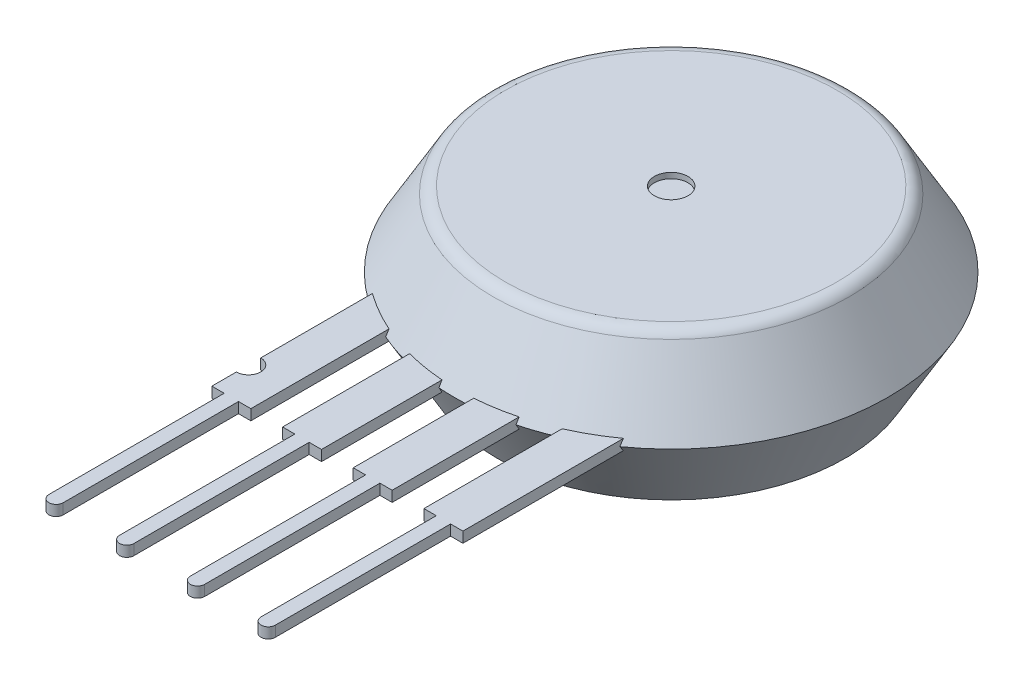
from build123d import *

# Parameters (mm, degrees)
ESQUISSE1_R                  = 7.8
BOSS_EXTRU_1_DEPTH           = 2.675
BOSS_EXTRU_1_TAPER           = 30
BOSS_EXTRU_1_OTHER_WAY_DEPTH = 2.675
BOSS_EXTRU_1_OTHER_WAY_TAPER = 30
BOSS_EXTRU_2_DEPTH           = 0.19
BOSS_EXTRU_2_DEPTH_BACK      = 0.19
ENL_V_MAT_EXTRU_1_DEPTH      = 1.19
ESQUISSE4_R                  = 0.604402157
ENL_V_MAT_EXTRU_2_DEPTH      = 0.2
ESQUISSE5_W                  = 1.06783848
ESQUISSE5_H                  = 1.016251764
ENL_V_MAT_EXTRU_3_DEPTH      = 0.2
CONG_1_R                     = 0.5


with BuildPart() as part:
    # Esquisse1 → Boss.-Extru.1 (new body)
    with BuildSketch(Plane(origin=(0, 0, 0), x_dir=(1, 0, 0), z_dir=(0, 1, 0))):
        Circle(ESQUISSE1_R)
    extrude(amount=BOSS_EXTRU_1_DEPTH, taper=BOSS_EXTRU_1_TAPER)

    # Esquisse1 → Boss.-Extru.1 other way (add)
    with BuildSketch(Plane(origin=(0, 0, 0), x_dir=(1, 0, 0), z_dir=(0, 1, 0))):
        Circle(ESQUISSE1_R)
    extrude(amount=-BOSS_EXTRU_1_OTHER_WAY_DEPTH, taper=BOSS_EXTRU_1_OTHER_WAY_TAPER)

    # Esquisse2 → Boss.-Extru.2 (add, two sides: drawn at the far end of the back side and taken through both)
    with BuildSketch(Plane(origin=(0, 0, 0), x_dir=(1, 0, 0), z_dir=(0, 1, 0)).offset(-BOSS_EXTRU_2_DEPTH_BACK)):
        with BuildLine():
            Line((1.969010028, -12), (1.969010028, -5.174670877))
            Line((1.969010028, -5.174670877), (0.570530435, -5.174670877))
            Line((0.570530435, -5.174670877), (0.570530435, -12))
            Line((0.570530435, -12), (1.014706926, -12))
            Line((1.014706926, -12), (1.014706926, -18.3))
            ThreePointArc((1.014706926, -18.3), (1.271696248, -18.556989322), (1.52868557, -18.3))
            Line((1.52868557, -18.3), (1.52868557, -12))
            Line((1.52868557, -12), (1.969010028, -12))
        make_face()
        with BuildLine():
            Line((4.069208585, -18.3), (4.069208585, -12))
            Line((4.069208585, -12), (4.512824501, -12))
            Line((4.512824501, -12), (4.512824501, -5.174670877))
            Line((4.512824501, -5.174670877), (3.110830289, -5.174670877))
            Line((3.110830289, -5.174670877), (3.110830289, -12))
            Line((3.110830289, -12), (3.555229941, -12))
            Line((3.555229941, -12), (3.555229941, -18.3))
            ThreePointArc((3.555229941, -18.3), (3.812219263, -18.556989322), (4.069208585, -18.3))
        make_face()
        with BuildLine():
            Line((-0.570530435, -5.174670877), (-0.570530435, -12))
            Line((-0.570530435, -12), (-1.014706926, -12))
            Line((-1.014706926, -12), (-1.014706926, -18.3))
            ThreePointArc((-1.014706926, -18.3), (-1.271696248, -18.556989322), (-1.52868557, -18.3))
            Line((-1.52868557, -18.3), (-1.52868557, -12))
            Line((-1.52868557, -12), (-1.969010028, -12))
            Line((-1.969010028, -12), (-1.969010028, -5.174670877))
            Line((-1.969010028, -5.174670877), (-0.570530435, -5.174670877))
        make_face()
        with BuildLine():
            Line((-4.512824501, -5.174670877), (-3.110830289, -5.174670877))
            Line((-3.110830289, -5.174670877), (-3.110830289, -12))
            Line((-3.110830289, -12), (-3.555229941, -12))
            Line((-3.555229941, -12), (-3.555229941, -18.3))
            ThreePointArc((-3.555229941, -18.3), (-3.812219263, -18.556989322), (-4.069208585, -18.3))
            Line((-4.069208585, -18.3), (-4.069208585, -12))
            Line((-4.069208585, -12), (-4.512824501, -12))
            Line((-4.512824501, -12), (-4.512824501, -5.174670877))
        make_face()
    extrude(amount=BOSS_EXTRU_2_DEPTH + BOSS_EXTRU_2_DEPTH_BACK)

    # Esquisse3 → Enlèv. mat.-Extru.1 (cut)
    with BuildSketch(Plane(origin=(0, 0.19, 0), x_dir=(1, 0, 0), z_dir=(0, 1, 0))):
        with BuildLine():
            Line((-4.512824501, -10.241819979), (-4.512824501, -11.117491511))
            ThreePointArc((-4.512824501, -11.117491511), (-4.074988736, -10.679655745), (-4.512824501, -10.241819979))
        make_face()
    extrude(amount=-ENL_V_MAT_EXTRU_1_DEPTH, mode=Mode.SUBTRACT)

    # Esquisse4 → Enlèv. mat.-Extru.2 (cut)
    with BuildSketch(Plane(origin=(0, 2.675, 0), x_dir=(1, 0, 0), z_dir=(0, 1, 0))):
        with Locations(Location((0, 0, 0), (0, 0, 270))):
            Circle(ESQUISSE4_R)
    extrude(amount=-ENL_V_MAT_EXTRU_2_DEPTH, mode=Mode.SUBTRACT)

    # Esquisse5 → Enlèv. mat.-Extru.3 (cut)
    with BuildSketch(Plane.XZ.offset(2.675)):
        Rectangle(ESQUISSE5_W, ESQUISSE5_H)
    extrude(amount=-ENL_V_MAT_EXTRU_3_DEPTH, mode=Mode.SUBTRACT)

    # Congé1
    cong_1_edges = [part.edges().sort_by_distance(p)[0] for p in [
        (-6.25558803, 2.675, 0),
    ]]
    fillet(cong_1_edges, radius=CONG_1_R)


solid = part.part
